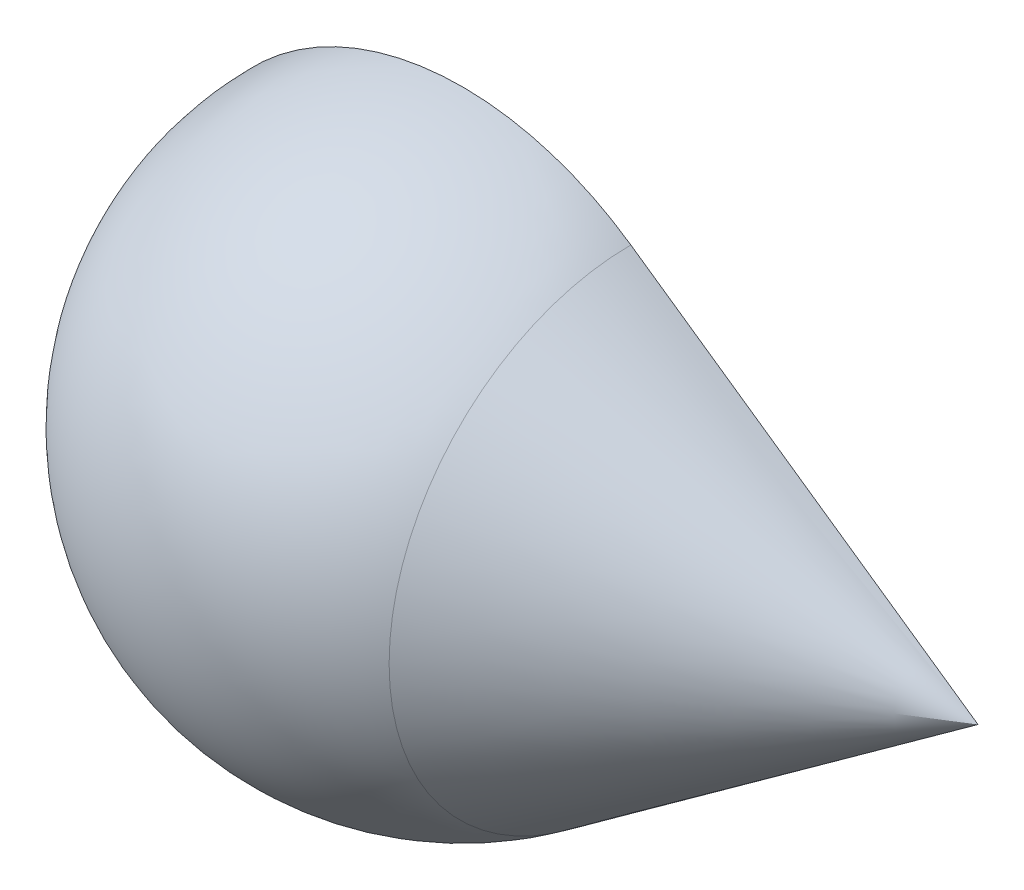
from build123d import *

# Parameters (mm, degrees)
REVOLVE_6_ANGLE = 180


with BuildPart() as part:
    # 草图1 → 旋转6 (revolve)
    with BuildSketch(Plane.XY):
        with BuildLine():
            Line((-40, 0), (70, 0))
            Line((70, 0), (22.857142857, 32.826072266))
            ThreePointArc((22.857142857, 32.826072266), (-18.516401995, 35.456210417), (-40, 0))
        make_face()
    revolve(axis=Axis((0, 0, 0), (1, 0, 0)), revolution_arc=REVOLVE_6_ANGLE)


solid = part.part
